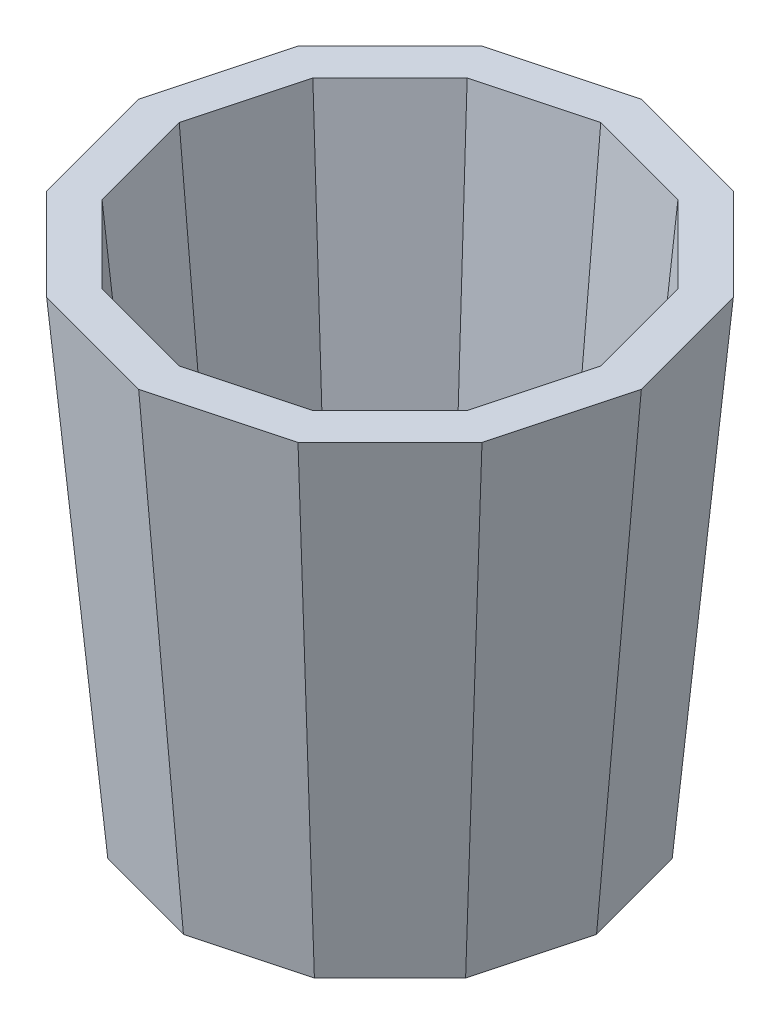
from build123d import *

# Parameters (mm, degrees)
BOSS_EXTRUDE1_DEPTH = 241.3
BOSS_EXTRUDE1_DRAFT = -5
SHELL1_T            = -19.05


with BuildPart() as part:
    # Sketch1 → Boss-Extrude1 (with draft: the straight prism first)
    with BuildSketch(Plane(origin=(0, 0, 0), x_dir=(1, 0, 0), z_dir=(0, 1, 0))):
        Polygon((122.672579939, 0), (106.237570575, 61.336289969), (61.336289969, 106.237570575), (0, 122.672579939), (-61.336289969, 106.237570575), (-106.237570575, 61.336289969), (-122.672579939, 0), (-106.237570575, -61.336289969), (-61.336289969, -106.237570575), (0, -122.672579939), (61.336289969, -106.237570575), (106.237570575, -61.336289969), align=None)
    extrude(amount=-BOSS_EXTRUDE1_DEPTH)
    # Boss-Extrude1: the draft: its side faces are tilted about the plane it starts from
    boss_extrude1_sides = [part.faces().sort_by_distance(p)[0] for p in [
        (114.455075257, -120.65, -30.668144985),
        (83.786930272, -120.65, -83.786930272),
        (30.668144985, -120.65, -114.455075257),
        (-30.668144985, -120.65, -114.455075257),
        (-83.786930272, -120.65, -83.786930272),
        (-114.455075257, -120.65, -30.668144985),
        (-114.455075257, -120.65, 30.668144985),
        (-83.786930272, -120.65, 83.786930272),
        (-30.668144985, -120.65, 114.455075257),
        (30.668144985, -120.65, 114.455075257),
        (83.786930272, -120.65, 83.786930272),
        (114.455075257, -120.65, 30.668144985),
    ]]
    draft(boss_extrude1_sides, Plane(origin=(0, 0, 0), x_dir=(1, 0, 0), z_dir=(0, 1, 0)), BOSS_EXTRUDE1_DRAFT)

    # Shell1
    shell1_openings = [part.faces().sort_by_distance(p)[0] for p in [
        (0, -241.3, 0),
        (0, 0, 0),
    ]]
    offset(amount=SHELL1_T, openings=shell1_openings, kind=Kind.INTERSECTION)


solid = part.part
